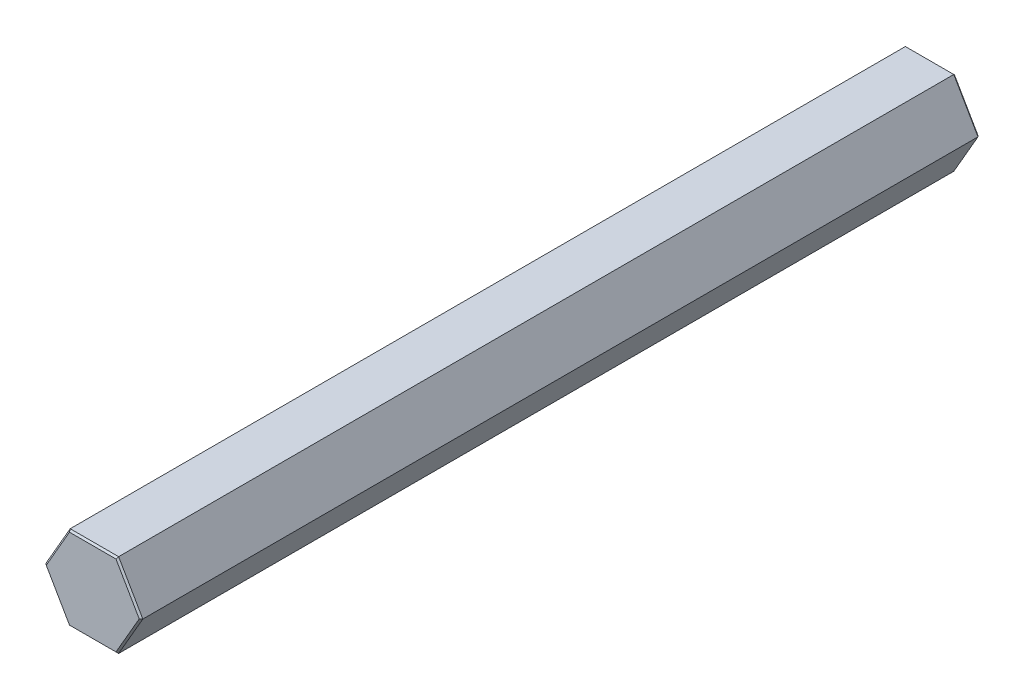
from build123d import *

# Parameters (mm, degrees)
BOSS_EXTRUDE1_DEPTH = 127
CHAMFER1_SIZE       = 0.254


with BuildPart() as part:
    # Sketch1 → Boss-Extrude1 (new body)
    with BuildSketch(Plane.XY.offset(127)):
        Polygon((3.666174209, -6.35), (7.332348419, 0), (3.666174209, 6.35), (-3.666174209, 6.35), (-7.332348419, 0), (-3.666174209, -6.35), align=None)
    extrude(amount=-BOSS_EXTRUDE1_DEPTH)

    # Chamfer1
    chamfer1_edges = [part.edges().sort_by_distance(p)[0] for p in [
        (5.499261314, 3.175, 0),
        (0, 6.35, 0),
        (-5.499261314, 3.175, 0),
        (-5.499261314, -3.175, 0),
        (0, -6.35, 0),
        (-5.499261314, -3.175, 127),
        (-5.499261314, 3.175, 127),
        (0, 6.35, 127),
        (5.499261314, -3.175, 0),
        (5.499261314, 3.175, 127),
        (5.499261314, -3.175, 127),
        (0, -6.35, 127),
    ]]
    chamfer(chamfer1_edges, length=CHAMFER1_SIZE)


solid = part.part
